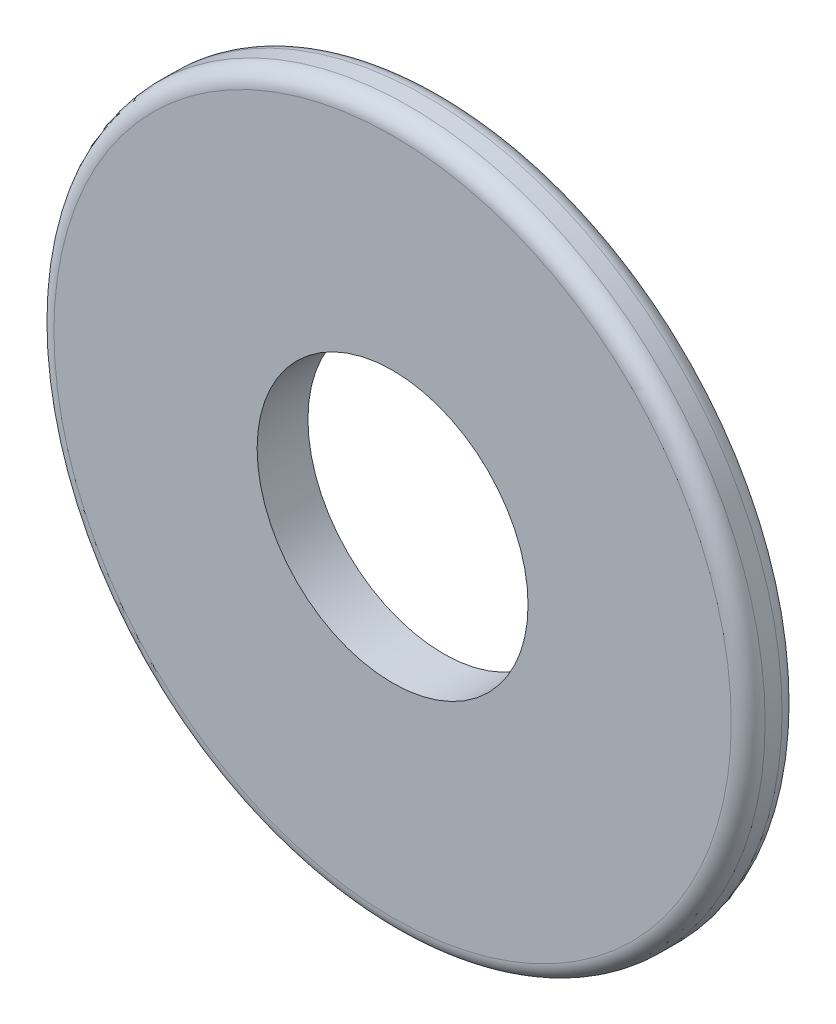
from build123d import *

# Parameters (mm, degrees)
SKETCH1_R           = 10.5
SKETCH1_R_2         = 4
BOSS_EXTRUDE1_DEPTH = 1.5
FILLET1_R           = 0.5


with BuildPart() as part:
    # Sketch1 → Boss-Extrude1 (new body)
    with BuildSketch(Plane.XY):
        Circle(SKETCH1_R)
        Circle(SKETCH1_R_2, mode=Mode.SUBTRACT)
    extrude(amount=BOSS_EXTRUDE1_DEPTH)

    # Fillet1
    fillet1_edges = [part.edges().sort_by_distance(p)[0] for p in [
        (-10.5, 0, 0),
        (-10.5, 0, 1.5),
    ]]
    fillet(fillet1_edges, radius=FILLET1_R)


solid = part.part
